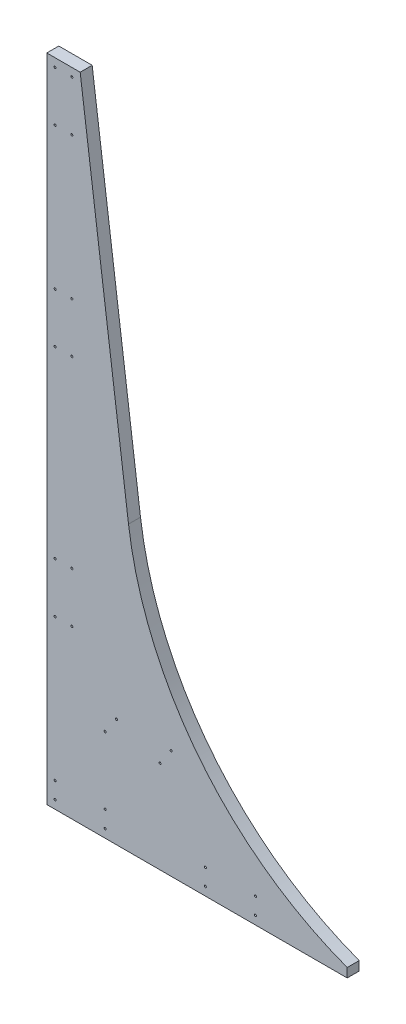
from build123d import *

# Parameters (mm, degrees)
BOSS_EXTRUDE1_DEPTH = 18.25625
SKETCH2_R           = 1.5875
CUT_EXTRUDE1_DEPTH  = 1092.171116308
SKETCH3_R           = 1.5875
CUT_EXTRUDE2_DEPTH  = 1092.171116308


with BuildPart() as part:
    # Sketch1 → Boss-Extrude1 (new body)
    with BuildSketch(Plane.XY):
        with BuildLine():
            Line((0, 990.6), (0, 0))
            Line((0, 0), (457.201, 0))
            Line((457.201, 0), (457.201, 13.862038208))
            ThreePointArc((457.201, 13.862038208), (232.767577124, 176.628269142), (124.367415652, 431.8))
            Line((124.367415652, 431.8), (50.8, 990.6))
            Line((50.8, 990.6), (0, 990.6))
        make_face()
    extrude(amount=BOSS_EXTRUDE1_DEPTH)

    # Sketch2 → Cut-Extrude1 (cut, through all)
    with BuildSketch(Plane.XY.offset(18.25625)):
        with Locations((12.7, 977.9)):
            Circle(SKETCH2_R)
        with Locations((38.1, 977.9)):
            Circle(SKETCH2_R)
        with Locations((12.7, 901.7)):
            Circle(SKETCH2_R)
        with Locations((38.1, 901.7)):
            Circle(SKETCH2_R)
        with Locations((12.7, 609.6)):
            Circle(SKETCH2_R)
        with Locations((38.1, 609.6)):
            Circle(SKETCH2_R)
        with Locations((12.7, 685.8)):
            Circle(SKETCH2_R)
        with Locations((38.1, 685.8)):
            Circle(SKETCH2_R)
        with Locations((12.7, 254)):
            Circle(SKETCH2_R)
        with Locations((38.1, 254)):
            Circle(SKETCH2_R)
        with Locations((12.7, 330.2)):
            Circle(SKETCH2_R)
        with Locations((38.1, 330.2)):
            Circle(SKETCH2_R)
        with Locations((12.7, 38.1)):
            Circle(SKETCH2_R)
        with Locations((12.7, 12.7)):
            Circle(SKETCH2_R)
        with Locations((88.9, 38.1)):
            Circle(SKETCH2_R)
        with Locations((88.9, 12.7)):
            Circle(SKETCH2_R)
        with Locations((241.3, 38.1)):
            Circle(SKETCH2_R)
        with Locations((317.5, 38.1)):
            Circle(SKETCH2_R)
        with Locations((241.3, 12.7)):
            Circle(SKETCH2_R)
        with Locations((317.5, 12.7)):
            Circle(SKETCH2_R)
    extrude(amount=-CUT_EXTRUDE1_DEPTH, mode=Mode.SUBTRACT)

    # Sketch3 → Cut-Extrude2 (cut, through all)
    with BuildSketch(Plane.XY.offset(18.25625)):
        with Locations((88.9, 140.661027566)):
            Circle(SKETCH3_R)
        with Locations((106.1212, 165.426027566)):
            Circle(SKETCH3_R)
        with Locations((189.3316, 165.426027566)):
            Circle(SKETCH3_R)
        with Locations((172.1104, 140.661027566)):
            Circle(SKETCH3_R)
    extrude(amount=-CUT_EXTRUDE2_DEPTH, mode=Mode.SUBTRACT)


solid = part.part
